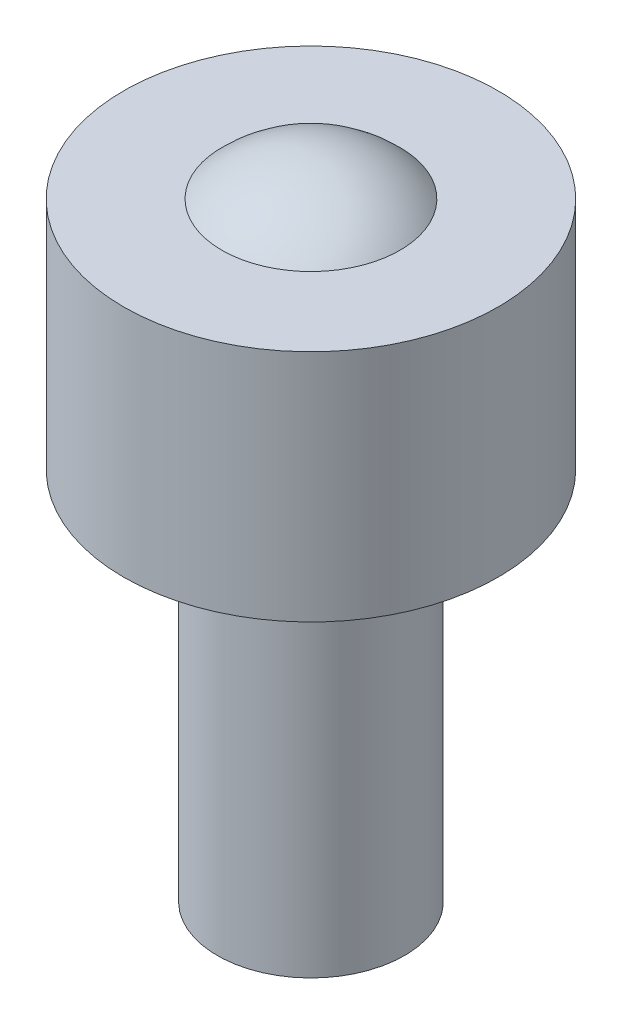
from build123d import *

# Parameters (mm, degrees)
ESQUISSE1_R        = 6
BOSS_EXTRU_1_DEPTH = 7.5
ESQUISSE3_R        = 3
BOSS_EXTRU_2_DEPTH = 12


with BuildPart() as part:
    # Esquisse1 → Boss.-Extru.1 (new body)
    with BuildSketch(Plane(origin=(0, 0, 0), x_dir=(1, 0, 0), z_dir=(0, 1, 0))):
        with Locations(Location((0, 0, 0), (0, 0, 270))):
            Circle(ESQUISSE1_R)
    extrude(amount=BOSS_EXTRU_1_DEPTH)

    # Esquisse3 → Boss.-Extru.2 (add)
    with BuildSketch(Plane.XZ):
        with Locations(Location((0, 0, 0), (0, 0, 270))):
            Circle(ESQUISSE3_R)
    extrude(amount=BOSS_EXTRU_2_DEPTH)


with BuildPart() as body_2:
    # Esquisse2 → Révolution6 (revolve)
    with BuildSketch(Plane(origin=(0, 0, 0), x_dir=(0, 0, -1), z_dir=(1, 0, 0))):
        with BuildLine():
            Line((0, 0.7), (0, 8.7))
            ThreePointArc((0, 8.7), (-4, 4.7), (0, 0.7))
        make_face()
    revolve(axis=Axis((0, 0, 0), (0, 1, 0)))


solid = Compound([part.part, body_2.part])
